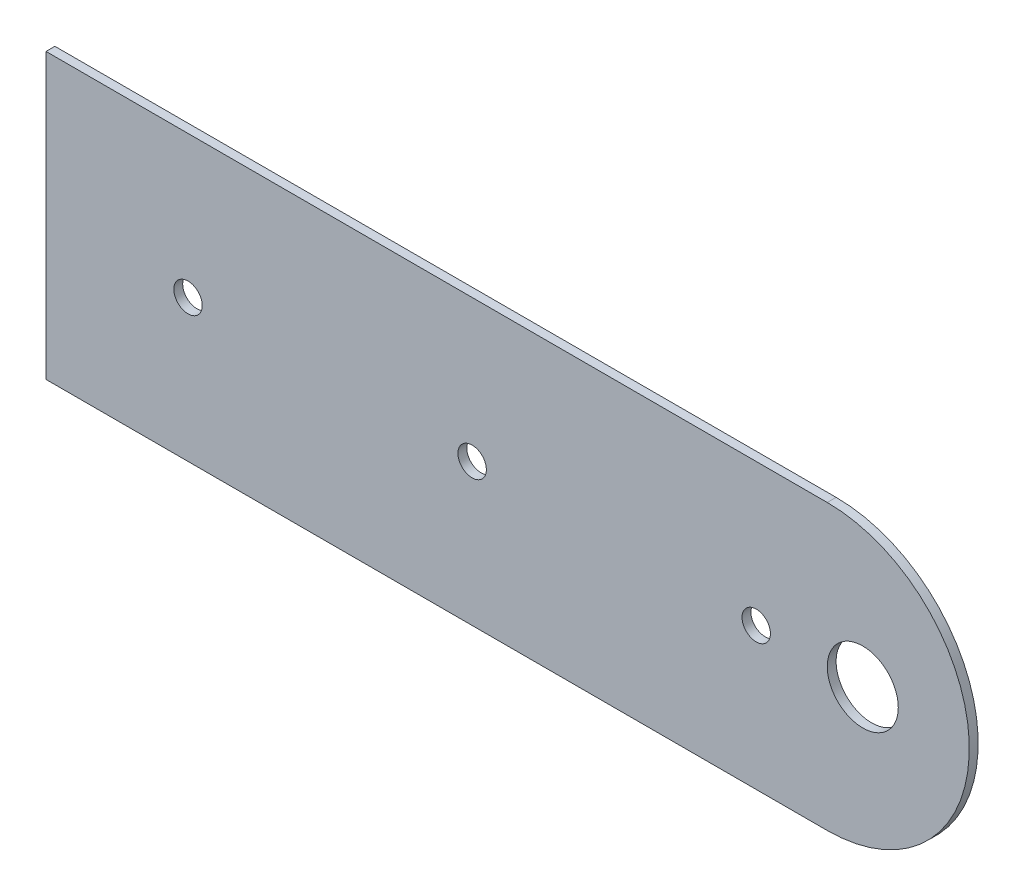
from build123d import *

# Parameters (mm, degrees)
SKETCH1_R           = 6.35
SKETCH1_R_2         = 2.54
BOSS_EXTRUDE1_DEPTH = 1.5875


with BuildPart() as part:
    # Sketch1 → Boss-Extrude1 (new body)
    with BuildSketch(Plane.XY):
        with BuildLine():
            Line((0, 0), (139.7, 0))
            ThreePointArc((139.7, 0), (165.1, 25.4), (139.7, 50.8))
            Line((139.7, 50.8), (0, 50.8))
            Line((0, 50.8), (0, 0))
        make_face()
        with Locations((146.05, 25.4)):
            Circle(SKETCH1_R, mode=Mode.SUBTRACT)
        with Locations((25.4, 25.4)):
            Circle(SKETCH1_R_2, mode=Mode.SUBTRACT)
        with Locations((76.2, 25.4)):
            Circle(SKETCH1_R_2, mode=Mode.SUBTRACT)
        with Locations((127, 25.4)):
            Circle(SKETCH1_R_2, mode=Mode.SUBTRACT)
    extrude(amount=BOSS_EXTRUDE1_DEPTH)


solid = part.part
